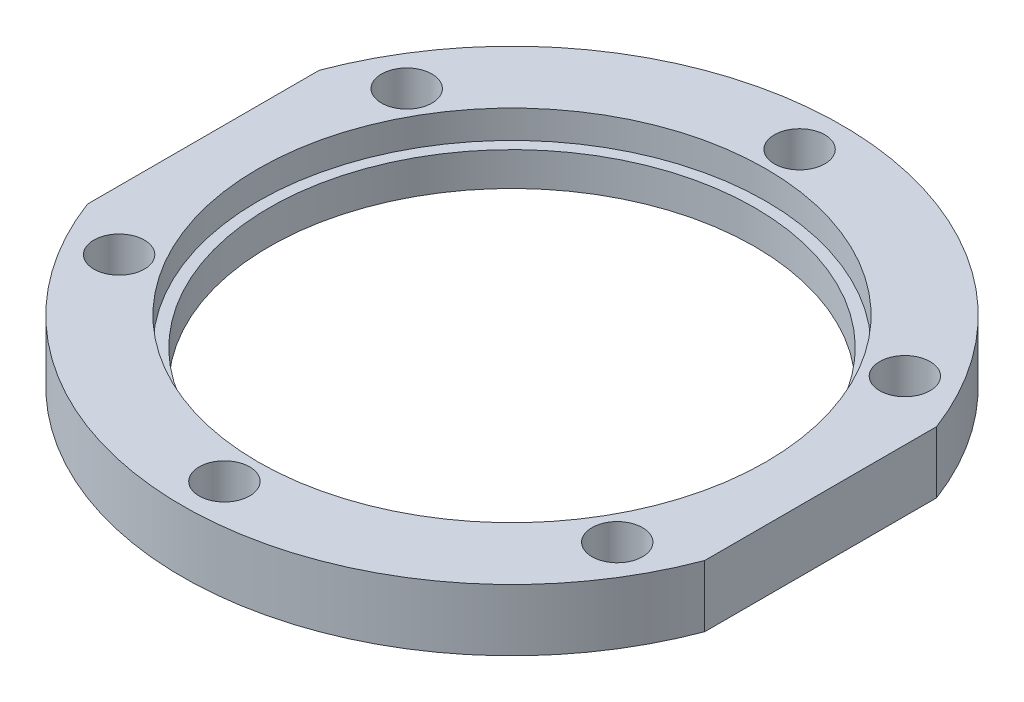
from build123d import *

# Parameters (mm, degrees)
CUT_EXTRUDE_1_DEPTH      = 168.620106193
SKETCH_3_R               = 9
CUT_EXTRUDE_2_DEPTH      = 163.450761771
PATTERN_CIRCULAR_1_COUNT = 6


with BuildPart() as part:
    # Эскиз1 → Повернуть1 (revolve)
    with BuildSketch(Plane.XY, mode=Mode.PRIVATE) as revolve_1_sk:
        Polygon((-90.5, 0), (-117.5, 0), (-117.5, -22), (-86.5, -22), (-86.5, -10), (-90.5, -10), align=None)
    revolve(revolve_1_sk.sketch.rotate(Axis((0, 22.934814099, 0), (0, -1, 0)), 270), axis=Axis((0, 22.934814099, 0), (0, -1, 0)))

    # Эскиз2 → Вырез-Вытянуть1 (cut, through all)
    with BuildSketch(Plane(origin=(0, 0, 0), x_dir=(1, 0, 0), z_dir=(0, 1, 0))):
        with BuildLine():
            Line((-110, 41.306779105), (-110, -41.306779105))
            ThreePointArc((-110, -41.306779105), (-117.5, 0), (-110, 41.306779105))
        make_face()
        with BuildLine():
            Line((110, 41.306779105), (110, -41.306779105))
            ThreePointArc((110, -41.306779105), (117.5, 0), (110, 41.306779105))
        make_face()
    extrude(amount=-CUT_EXTRUDE_1_DEPTH, mode=Mode.SUBTRACT)

    # Эскиз3 → Вырез-Вытянуть2 (cut, through all)
    with BuildSketch(Plane(origin=(0, 0, 0), x_dir=(1, 0, 0), z_dir=(0, 1, 0))):
        with Locations(Location((0, 102.5, 0), (0, 0, 270))):
            Circle(SKETCH_3_R)
    cut_extrude_2 = extrude(amount=-CUT_EXTRUDE_2_DEPTH, mode=Mode.SUBTRACT)

    # Круговой массив1: Вырез-Вытянуть2 ×6 about axis
    pattern_circular_1_axis = Axis((0, 0, 0), (0, 1, 0))
    for i in range(1, PATTERN_CIRCULAR_1_COUNT):
        add(cut_extrude_2.rotate(pattern_circular_1_axis, i * 360 / PATTERN_CIRCULAR_1_COUNT), mode=Mode.SUBTRACT)


solid = part.part
